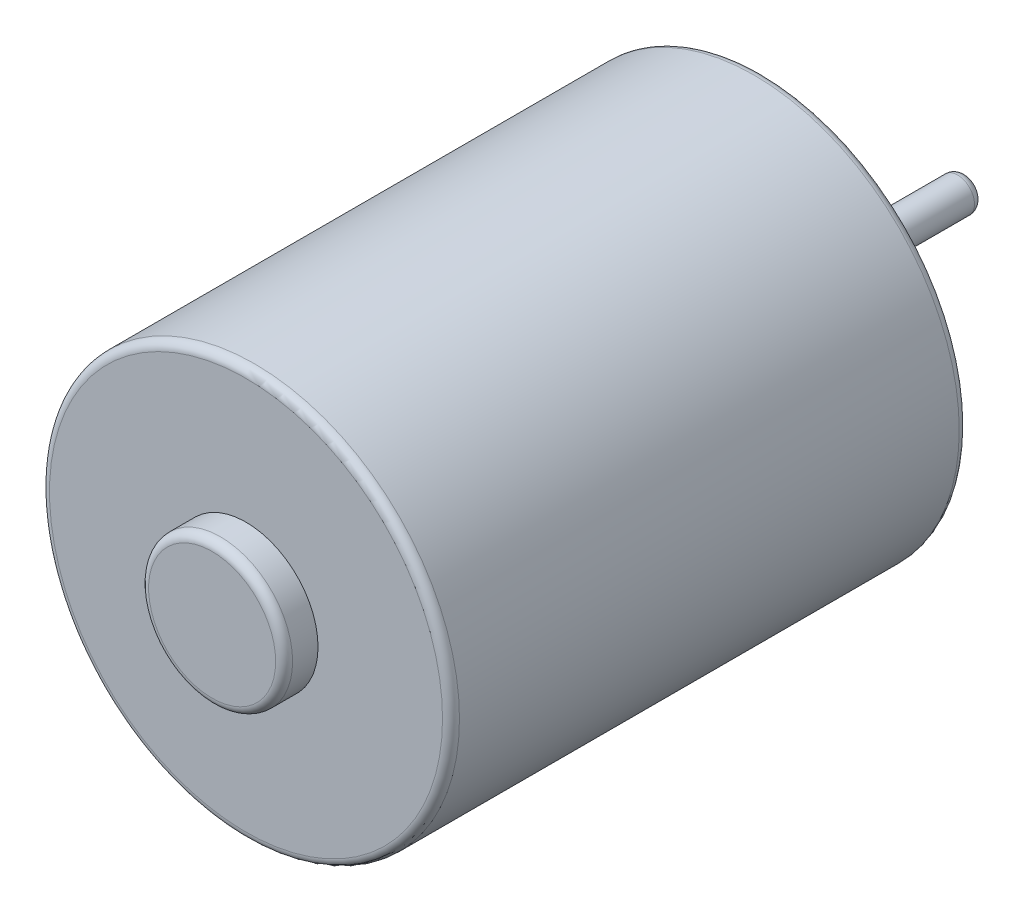
from build123d import *

# Parameters (mm, degrees)
SKETCH1_R           = 12.1
BOSS_EXTRUDE1_DEPTH = 30.5
SKETCH1_3_R         = 1
BOSS_EXTRUDE2_DEPTH = 12
SKETCH1_4_R         = 3.175
SKETCH1_4_R_2       = 1
BOSS_EXTRUDE3_DEPTH = 1.6
SKETCH2_R           = 4.25
BOSS_EXTRUDE4_DEPTH = 2
FILLET1_R           = 0.5


with BuildPart() as part:
    # Sketch1 → Boss-Extrude1 (new body)
    with BuildSketch(Plane.XY):
        Circle(SKETCH1_R)
    extrude(amount=BOSS_EXTRUDE1_DEPTH)

    # Sketch1<3> → Boss-Extrude2 (add)
    with BuildSketch(Plane.XY):
        Circle(SKETCH1_3_R)
    extrude(amount=-BOSS_EXTRUDE2_DEPTH)

    # Sketch1<4> → Boss-Extrude3 (add)
    with BuildSketch(Plane.XY):
        Circle(SKETCH1_4_R)
        Circle(SKETCH1_4_R_2, mode=Mode.SUBTRACT)
    extrude(amount=-BOSS_EXTRUDE3_DEPTH)

    # Sketch2 → Boss-Extrude4 (add)
    with BuildSketch(Plane.XY.offset(30.5)):
        Circle(SKETCH2_R)
    extrude(amount=BOSS_EXTRUDE4_DEPTH)

    # Fillet1
    fillet1_edges = [part.edges().sort_by_distance(p)[0] for p in [
        (-1, 0, -12),
        (-3.175, 0, -1.6),
        (-12.1, 0, 0),
        (-4.25, 0, 32.5),
        (-12.1, 0, 30.5),
    ]]
    fillet(fillet1_edges, radius=FILLET1_R)


solid = part.part
